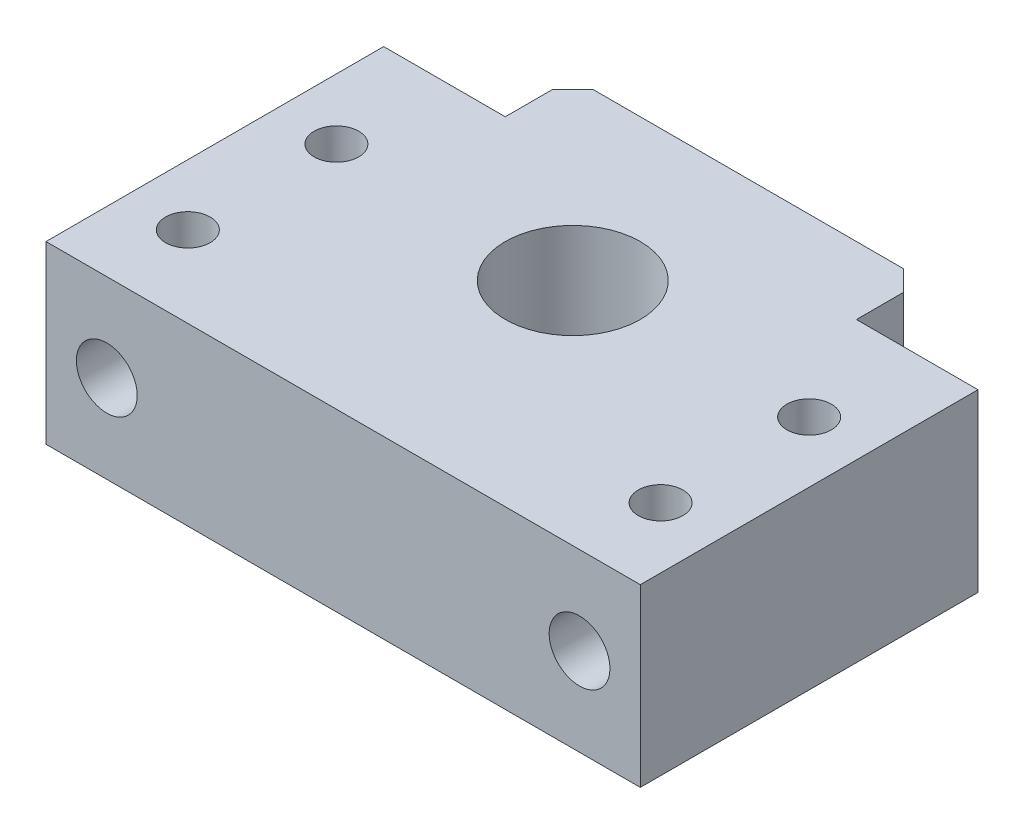
from build123d import *

# Parameters (mm, degrees)
SKETCH_1_R          = 3.3
EXTRUDE_1_DEPTH     = 26
CHAMFER_1_SIZE      = 3
SKETCH_2_R          = 7
CUT_EXTRUDE_1_DEPTH = 12
SKETCH_3_R          = 4.5
CUT_EXTRUDE_2_DEPTH = 64.686733312


with BuildPart() as part:
    # 草图1 → 凸台-拉伸1 (new body)
    # profile 1 of 2: a face of its own
    with BuildSketch(Plane(origin=(0, 0, 0), x_dir=(1, 0, 0), z_dir=(0, 1, 0))):
        with BuildLine():
            Line((0, 19), (0, 35))
            Line((0, 35), (-26, 35))
            Line((-26, 35), (-26, 25))
            Line((-26, 25), (-44, 25))
            Line((-44, 25), (-44, -25))
            Line((-44, -25), (0, -25))
            Line((0, -25), (0, -1))
            ThreePointArc((0, -1), (-10, 9), (0, 19))
        make_face()
        with Locations(Location((-35, -13, 0), (0, 0, 90))):
            Circle(SKETCH_1_R, mode=Mode.SUBTRACT)
        with Locations(Location((-35, 9, 0), (0, 0, 90))):
            Circle(SKETCH_1_R, mode=Mode.SUBTRACT)
    # profile 2 of 2: a face of its own
    with BuildSketch(Plane(origin=(0, 0, 0), x_dir=(1, 0, 0), z_dir=(0, 1, 0))):
        with BuildLine():
            Line((26, 35), (0, 35))
            Line((0, 35), (0, 19))
            ThreePointArc((0, 19), (7.071067812, 16.071067812), (10, 9))
            ThreePointArc((10, 9), (7.071067812, 1.928932188), (0, -1))
            Line((0, -1), (0, -25))
            Line((0, -25), (44, -25))
            Line((44, -25), (44, 25))
            Line((44, 25), (26, 25))
            Line((26, 25), (26, 35))
        make_face()
        with Locations(Location((35, -13, 0), (0, 0, 90))):
            Circle(SKETCH_1_R, mode=Mode.SUBTRACT)
        with Locations(Location((35, 9, 0), (0, 0, 90))):
            Circle(SKETCH_1_R, mode=Mode.SUBTRACT)
    extrude(amount=EXTRUDE_1_DEPTH)

    # 倒角1
    chamfer_1_edges = [part.edges().sort_by_distance(p)[0] for p in [
        (-26, 13, -35),
        (26, 13, -35),
    ]]
    chamfer(chamfer_1_edges, length=CHAMFER_1_SIZE)

    # 草图2 → 切除-拉伸1 (cut)
    with BuildSketch(Plane(origin=(0, 0, -25), x_dir=(-1, 0, 0), z_dir=(0, 0, -1))):
        with Locations((-35, 13)):
            Circle(SKETCH_2_R)
        with Locations(Location((35, 13, 0), (0, 0, 180))):
            Circle(SKETCH_2_R)
    extrude(amount=-CUT_EXTRUDE_1_DEPTH, mode=Mode.SUBTRACT)

    # 草图3 → 切除-拉伸2 (cut, through all)
    with BuildSketch(Plane(origin=(0, 0, -13), x_dir=(-1, 0, 0), z_dir=(0, 0, -1))):
        with Locations((-35, 13)):
            Circle(SKETCH_3_R)
        with Locations((35, 13)):
            Circle(SKETCH_3_R)
    extrude(amount=-CUT_EXTRUDE_2_DEPTH, mode=Mode.SUBTRACT)


solid = part.part
